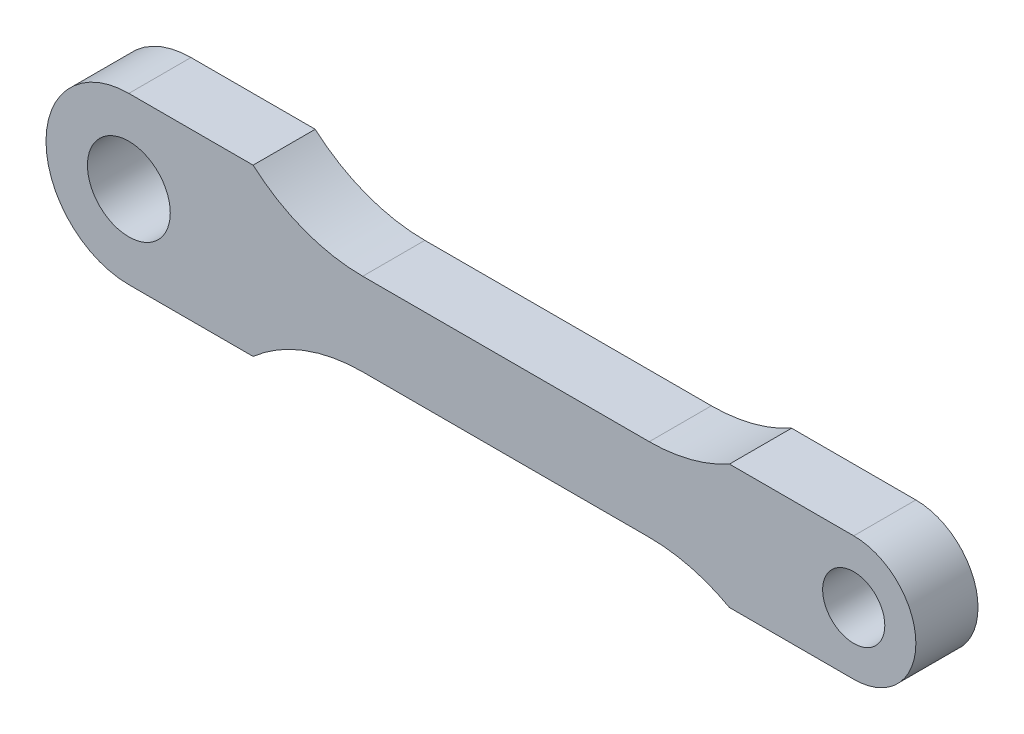
from build123d import *

# Parameters (mm, degrees)
SKETCH1_R           = 2
SKETCH1_R_2         = 1.5
BOSS_EXTRUDE2_DEPTH = 1.5


with BuildPart() as part:
    # Sketch1 → Boss-Extrude2 (new, symmetric)
    with BuildSketch(Plane.XY):
        with BuildLine():
            Line((0, 2), (7.627016654, 2))
            ThreePointArc((7.627016654, 2), (9.627016654, 2.254033308), (11.5, 3))
            Line((11.5, 3), (17.5, 3))
            ThreePointArc((17.5, 3), (20.5, 0), (17.5, -3))
            Line((17.5, -3), (11.5, -3))
            ThreePointArc((11.5, -3), (9.627016654, -2.254033308), (7.627016654, -2))
            Line((7.627016654, -2), (0, -2))
            Line((0, -2), (-6.208497378, -2))
            ThreePointArc((-6.208497378, -2), (-9.036924503, -2.516685226), (-11.5, -4))
            Line((-11.5, -4), (-17.5, -4))
            ThreePointArc((-17.5, -4), (-21.5, 0), (-17.5, 4))
            Line((-17.5, 4), (-11.5, 4))
            ThreePointArc((-11.5, 4), (-9.036924503, 2.516685226), (-6.208497378, 2))
            Line((-6.208497378, 2), (0, 2))
        make_face()
        with Locations((-17.5, 0)):
            Circle(SKETCH1_R, mode=Mode.SUBTRACT)
        with Locations((17.5, 0)):
            Circle(SKETCH1_R_2, mode=Mode.SUBTRACT)
    extrude(amount=BOSS_EXTRUDE2_DEPTH, both=True)


solid = part.part
